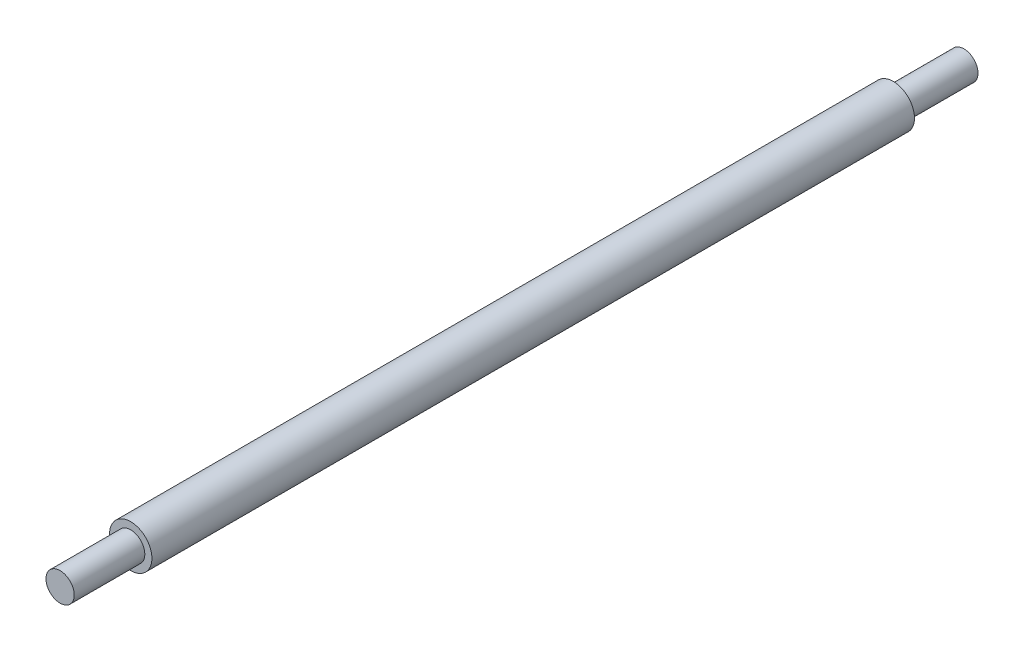
from build123d import *

# Parameters (mm, degrees)
SKETCH1_R           = 9.525
BOSS_EXTRUDE1_DEPTH = 342.9
SKETCH2_R           = 6.35
BOSS_EXTRUDE2_DEPTH = 31.75
BOSS_EXTRUDE3_START = 31.75
SKETCH3_R           = 6.35
BOSS_EXTRUDE3_DEPTH = 31.75


with BuildPart() as part:
    # Sketch1 → Boss-Extrude1 (new body)
    with BuildSketch(Plane.XY):
        Circle(SKETCH1_R)
    extrude(amount=BOSS_EXTRUDE1_DEPTH)

    # Sketch2 → Boss-Extrude2 (add)
    with BuildSketch(Plane.XY.offset(342.9)):
        Circle(SKETCH2_R)
    extrude(amount=BOSS_EXTRUDE2_DEPTH)

    # Sketch3 → Boss-Extrude3 (add)
    with BuildSketch(Plane(origin=(0, 0, 0), x_dir=(-1, 0, 0), z_dir=(0, 0, -1)).offset(BOSS_EXTRUDE3_START)):
        with Locations(Location((0, 0, 0), (0, 0, 180))):
            Circle(SKETCH3_R)
    extrude(amount=-BOSS_EXTRUDE3_DEPTH)


solid = part.part
